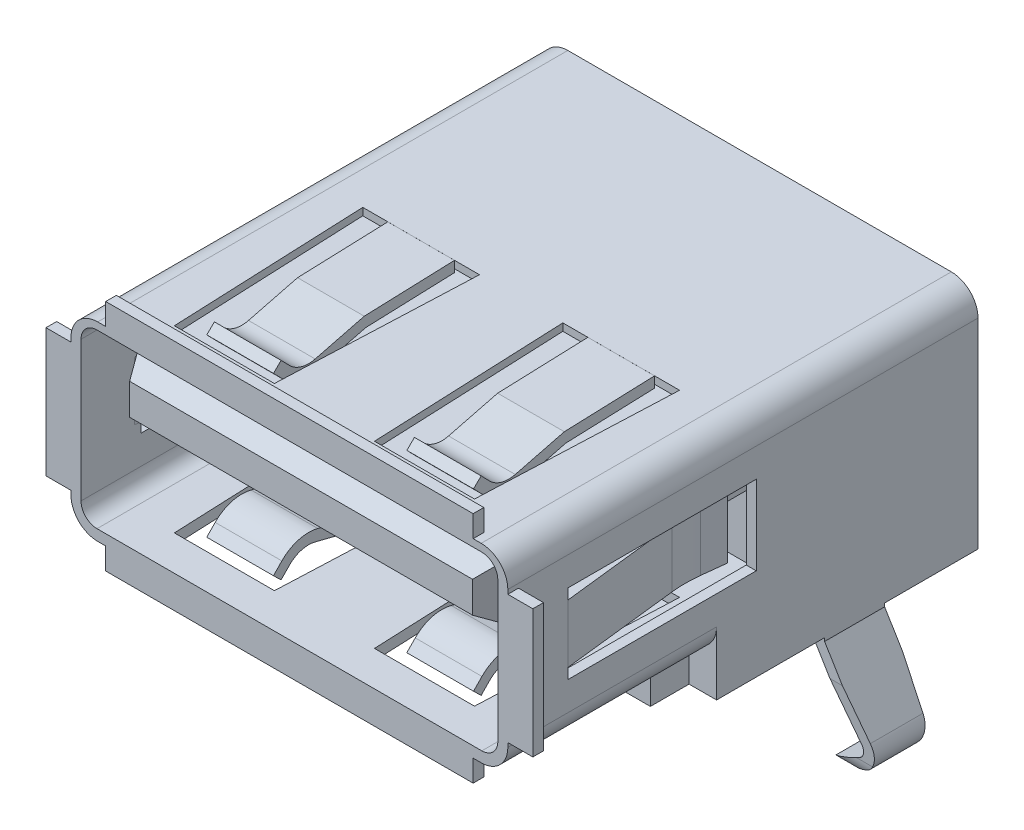
from build123d import *
from OCP.BRepFilletAPI import BRepFilletAPI_MakeChamfer

# Parameters (mm, degrees)
SKETCH1_W                           = 13.1
SKETCH1_H                           = 14.1
BASE_DEPTH                          = 5.7
SKETCH3_W                           = 11.02
SKETCH3_H                           = 0.65
SKETCH3_W_2                         = 0.75
SKETCH3_H_2                         = 3.85
FRONT_TABS_DEPTH                    = 0.32
CORNER_FILLETS_R                    = 0.8
D_BACK_STEP_DEPTH                   = 7.84
SKETCH19_W                          = 11.45
SKETCH19_H                          = 1.16
D_BOTTOM_STEP_DEPTH                 = 1.1
S_BACK_STEP_DEPTH                   = 5.2
SKETCH21_W                          = 2.4
SKETCH21_H                          = 3.2
S_BOTTOM_STEP_DEPTH                 = 1.1
GROUND_TAIL_1_DEPTH                 = 0.9
GROUND_TAIL_1_SHAPE_DEPTH           = 8
SKETCH23_W                          = 0.6604
SKETCH23_H                          = 0.31
TH_CONTACT_TAIL_DEPTH               = 3.9
CONTACT_AREA_CUTOUT_DEPTH           = 8.85
TOP_BOTTOM_FLANGE_CUTOUT_DEPTH      = 5.8
TOP_BOTTOM_FLANGE_DEPTH             = 1
TOP_BOTTOM_FLANGE_PATTERN_COUNT     = 2
TOP_BOTTOM_FLANGE_PATTERN_PITCH     = 6
SKETCH14_W                          = 5.65
SKETCH14_H                          = 2.38
SIDE_FLANGE_CUTOUT_DEPTH            = 18.286627863
SIDE_FLANGE_DEPTH                   = 0.875
SKETCH16_W                          = 11.15
SKETCH16_H                          = 1.8
CONTACT_GUIDE_DEPTH                 = 8.5
CONTACT_GUIDE_LEAD_IN_SIZE          = 0.75
CONTACT_GUIDE_LEAD_IN_SIZE2         = 0.433012702
CONTACT_DEPTH                       = 0.33
CONTACT_PATTERN_COUNT               = 2
CONTACT_PATTERN_PITCH               = 2.5
CONTACT_PATTERN_MIRROR_COPY_1_DEPTH = 0.33


with BuildPart() as part:
    # Sketch1 → Base (new body)
    with BuildSketch(Plane(origin=(0, 0, 0), x_dir=(1, 0, 0), z_dir=(0, 1, 0))):
        Rectangle(SKETCH1_W, SKETCH1_H)
    extrude(amount=BASE_DEPTH)

    # Sketch3 → Front Tabs (add)
    with BuildSketch(Plane.XY.offset(7.05)):
        with Locations((0, 6.025)):
            Rectangle(SKETCH3_W, SKETCH3_H)
        with Locations((6.925, 2.85)):
            Rectangle(SKETCH3_W_2, SKETCH3_H_2)
        with Locations((0, -0.325)):
            Rectangle(SKETCH3_W, SKETCH3_H)
        with Locations((-6.925, 2.85)):
            Rectangle(SKETCH3_W_2, SKETCH3_H_2)
    extrude(amount=-FRONT_TABS_DEPTH)

    # Corner Fillets
    corner_fillets_edges = [part.edges().sort_by_distance(p)[0] for p in [
        (-6.55, 5.7, 0),
        (-6.55, 0, 0),
        (6.55, 0, 0),
        (6.55, 5.7, 0),
    ]]
    fillet(corner_fillets_edges, radius=CORNER_FILLETS_R)

    # Sketch18 → -D Back Step (add)
    with BuildSketch(Plane(origin=(0, 0, -7.05), x_dir=(-1, 0, 0), z_dir=(0, 0, -1))):
        with BuildLine():
            Line((-6.55, 0.8), (-6.55, -1.1))
            Line((-6.55, -1.1), (6.55, -1.1))
            Line((6.55, -1.1), (6.55, 0.8))
            ThreePointArc((6.55, 0.8), (6.315685425, 0.234314575), (5.75, 0))
            Line((5.75, 0), (-5.75, 0))
            ThreePointArc((-5.75, 0), (-6.315685425, 0.234314575), (-6.55, 0.8))
        make_face()
    extrude(amount=-D_BACK_STEP_DEPTH)

    # Sketch19 → -D Bottom Step (add)
    with BuildSketch(Plane.XZ):
        with Locations((0, 1.37)):
            Rectangle(SKETCH19_W, SKETCH19_H)
    extrude(amount=D_BOTTOM_STEP_DEPTH)

    # Sketch22 → -S Back Step (add)
    with BuildSketch(Plane(origin=(0, 0, -7.05), x_dir=(-1, 0, 0), z_dir=(0, 0, -1))):
        with BuildLine():
            Line((-6.55, 0.8), (-6.55, -1.1))
            Line((-6.55, -1.1), (6.55, -1.1))
            Line((6.55, -1.1), (6.55, 0.8))
            ThreePointArc((6.55, 0.8), (6.315685425, 0.234314575), (5.75, 0))
            Line((5.75, 0), (-5.75, 0))
            ThreePointArc((-5.75, 0), (-6.315685425, 0.234314575), (-6.55, 0.8))
        make_face()
    extrude(amount=-S_BACK_STEP_DEPTH)

    # Sketch21 → -S Bottom Step (add)
    with BuildSketch(Plane.XZ):
        with Locations((0, -0.25)):
            Rectangle(SKETCH21_W, SKETCH21_H)
    extrude(amount=S_BOTTOM_STEP_DEPTH)

    # Sketch10 → Ground Tail 1 (add, symmetric)
    with BuildSketch(Plane.XY.offset(-3.35)):
        with BuildLine():
            Line((6.55, -1.2), (6.55, -1.1))
            Line((6.55, -1.1), (6.23, -1.1))
            Line((6.23, -1.1), (6.23, -1.289427281))
            Line((6.23, -1.289427281), (7.53653566, -3.444470404))
            ThreePointArc((7.53653566, -3.444470404), (7.568809506, -3.681173083), (7.417946806, -3.866403226))
            Line((7.417946806, -3.866403226), (6.55, -4.315836559))
            Line((6.55, -4.315836559), (6.69714326, -4.6))
            Line((6.69714326, -4.6), (7.565090066, -4.150566667))
            ThreePointArc((7.565090066, -4.150566667), (7.876872978, -3.767757706), (7.810173696, -3.278572167))
            Line((7.810173696, -3.278572167), (6.55, -1.2))
        make_face()
        with BuildLine():
            Line((-6.55, -1.1), (-6.23, -1.1))
            Line((-6.23, -1.1), (-6.23, -1.289427281))
            Line((-6.23, -1.289427281), (-7.53653566, -3.444470404))
            ThreePointArc((-7.53653566, -3.444470404), (-7.568809506, -3.681173083), (-7.417946806, -3.866403226))
            Line((-7.417946806, -3.866403226), (-6.55, -4.315836559))
            Line((-6.55, -4.315836559), (-6.69714326, -4.6))
            Line((-6.69714326, -4.6), (-7.565090066, -4.150566667))
            ThreePointArc((-7.565090066, -4.150566667), (-7.876872978, -3.767757706), (-7.810173696, -3.278572167))
            Line((-7.810173696, -3.278572167), (-6.55, -1.2))
            Line((-6.55, -1.2), (-6.55, -1.1))
        make_face()
    extrude(amount=GROUND_TAIL_1_DEPTH, both=True)

    # Sketch11 → Ground Tail 1 Shape (cut, symmetric)
    with BuildSketch(Plane(origin=(0, 0, 0), x_dir=(0, 0, -1), z_dir=(1, 0, 0))):
        with BuildLine():
            Line((2.425, -1.809071665), (2.618297835, -3.906504778))
            ThreePointArc((2.618297835, -3.906504778), (3.35, -4.573874551), (4.081702165, -3.906504778))
            Line((4.081702165, -3.906504778), (4.275, -1.809071665))
            Line((4.275, -1.809071665), (4.275, -4.939071665))
            Line((4.275, -4.939071665), (2.425, -4.939071665))
            Line((2.425, -4.939071665), (2.425, -1.809071665))
        make_face()
    extrude(amount=GROUND_TAIL_1_SHAPE_DEPTH, both=True, mode=Mode.SUBTRACT)

    # Sketch23 → -TH Contact Tail (add)
    with BuildSketch(Plane.XZ):
        with Locations((-3.5098, -6.0678)):
            Rectangle(SKETCH23_W, SKETCH23_H)
        with Locations((3.4902, -6.0678)):
            Rectangle(SKETCH23_W, SKETCH23_H)
        with Locations((-1.0098, -6.0678)):
            Rectangle(SKETCH23_W, SKETCH23_H)
        with Locations((0.9902, -6.0678)):
            Rectangle(SKETCH23_W, SKETCH23_H)
    extrude(amount=TH_CONTACT_TAIL_DEPTH)

    # Sketch8 → Contact Area Cutout (cut)
    with BuildSketch(Plane.XY.offset(7.05)):
        with BuildLine():
            Line((-6.25, 5), (-6.25, 0.8))
            ThreePointArc((-6.25, 0.8), (-6.109411255, 0.460588745), (-5.77, 0.32))
            Line((-5.77, 0.32), (5.77, 0.32))
            ThreePointArc((5.77, 0.32), (6.109411255, 0.460588745), (6.25, 0.8))
            Line((6.25, 0.8), (6.25, 5))
            ThreePointArc((6.25, 5), (6.109411255, 5.339411255), (5.77, 5.48))
            Line((5.77, 5.48), (-5.77, 5.48))
            ThreePointArc((-5.77, 5.48), (-6.109411255, 5.339411255), (-6.25, 5))
        make_face()
    extrude(amount=-CONTACT_AREA_CUTOUT_DEPTH, mode=Mode.SUBTRACT)

    # Sketch12 → Top/Bottom Flange Cutout (cut)
    with BuildSketch(Plane(origin=(0, 0, 0), x_dir=(-1, 0, 0), z_dir=(0, 1, 0))):
        Polygon((4.5, 6), (4.75, 0.1), (1.25, 0.1), (1.5, 6), align=None)
        Polygon((-4.75, 0.1), (-1.25, 0.1), (-1.5, 6), (-4.5, 6), align=None)
    extrude(amount=TOP_BOTTOM_FLANGE_CUTOUT_DEPTH, mode=Mode.SUBTRACT)

    # Sketch13 → Top/Bottom Flange (add, symmetric)
    with BuildSketch(Plane(origin=(-3, 0, 0), x_dir=(0, 0, -1), z_dir=(1, 0, 0))):
        with BuildLine():
            Line((-2.760063847, 0.417489088), (-4.198269078, 0.784212886))
            ThreePointArc((-4.198269078, 0.784212886), (-4.778069903, 0.777154214), (-5.276638422, 0.481099735))
            Line((-5.276638422, 0.481099735), (-5.529039549, 0.222413302))
            Line((-5.529039549, 0.222413302), (-5.3, -0.001061272))
            Line((-5.3, -0.001061272), (-5.047598873, 0.257625162))
            ThreePointArc((-5.047598873, 0.257625162), (-4.691478502, 0.469092647), (-4.277335056, 0.474134555))
            Line((-4.277335056, 0.474134555), (-2.8059045, 0.098938728))
            Line((-2.8059045, 0.098938728), (-0.1, 0.001))
            Line((-0.1, 0.001), (-0.1, 0.321209538))
            Line((-0.1, 0.321209538), (-2.760063847, 0.417489088))
        make_face()
        with BuildLine():
            Line((-2.8059045, 5.601061272), (-4.277335056, 5.225865445))
            ThreePointArc((-4.277335056, 5.225865445), (-4.691478502, 5.230907353), (-5.047598873, 5.442374838))
            Line((-5.047598873, 5.442374838), (-5.3, 5.701061272))
            Line((-5.3, 5.701061272), (-5.529039549, 5.477586698))
            Line((-5.529039549, 5.477586698), (-5.276638422, 5.218900265))
            ThreePointArc((-5.276638422, 5.218900265), (-4.778069903, 4.922845786), (-4.198269078, 4.915787114))
            Line((-4.198269078, 4.915787114), (-2.760063847, 5.282510912))
            Line((-2.760063847, 5.282510912), (-0.1, 5.378790462))
            Line((-0.1, 5.378790462), (-0.1, 5.699))
            Line((-0.1, 5.699), (-2.8059045, 5.601061272))
        make_face()
    top_bottom_flange = extrude(amount=TOP_BOTTOM_FLANGE_DEPTH, both=True)

    # Top/Bottom Flange Pattern: Top/Bottom Flange ×2
    with Locations(*[(i * TOP_BOTTOM_FLANGE_PATTERN_PITCH, 0, 0) for i in range(1, TOP_BOTTOM_FLANGE_PATTERN_COUNT)]):
        add(top_bottom_flange)

    # Sketch14 → Side Flange Cutout (cut, through all)
    with BuildSketch(Plane(origin=(6.55, 0, 0), x_dir=(0, 0, -1), z_dir=(1, 0, 0))):
        with Locations((-2.425, 2.85)):
            Rectangle(SKETCH14_W, SKETCH14_H)
    extrude(amount=-SIDE_FLANGE_CUTOUT_DEPTH, mode=Mode.SUBTRACT)

    # Sketch15 → Side Flange (add, symmetric)
    with BuildSketch(Plane(origin=(0, 2.85, 0), x_dir=(-1, 0, 0), z_dir=(0, 1, 0))):
        with BuildLine():
            Line((6.55, 5.25), (6.149012428, 1.723694006))
            ThreePointArc((6.149012428, 1.723694006), (6.125000079, 1.300770202), (6.148838699, 0.87783657))
            Line((6.148838699, 0.87783657), (6.231300503, 0.15))
            Line((6.231300503, 0.15), (5.913334739, 0.113975387))
            Line((5.913334739, 0.113975387), (5.830872935, 0.841811958))
            ThreePointArc((5.830872935, 0.841811958), (5.805000086, 1.300835926), (5.831061488, 1.759849227))
            Line((5.831061488, 1.759849227), (6.25, 5.444016737))
            Line((6.25, 5.444016737), (6.55, 5.25))
        make_face()
        with BuildLine():
            Line((-5.913334739, 0.113975387), (-6.231300503, 0.15))
            Line((-6.231300503, 0.15), (-6.148838699, 0.87783657))
            ThreePointArc((-6.148838699, 0.87783657), (-6.125000079, 1.300770202), (-6.149012428, 1.723694006))
            Line((-6.149012428, 1.723694006), (-6.55, 5.25))
            Line((-6.55, 5.25), (-6.25, 5.444016737))
            Line((-6.25, 5.444016737), (-5.831061488, 1.759849227))
            ThreePointArc((-5.831061488, 1.759849227), (-5.805000086, 1.300835926), (-5.830872935, 0.841811958))
            Line((-5.830872935, 0.841811958), (-5.913334739, 0.113975387))
        make_face()
    extrude(amount=SIDE_FLANGE_DEPTH, both=True)

    # Sketch16 → Contact Guide (add)
    with BuildSketch(Plane.XY.offset(-1.8)):
        with Locations((0, 3.82)):
            Rectangle(SKETCH16_W, SKETCH16_H)
    extrude(amount=CONTACT_GUIDE_DEPTH)

    # Contact Guide Lead-in: one chamfer whose edges measure the first distance from different faces: ONE call of the kernel's chamfer builder (chamfer() names one face for all edges)
    contact_guide_lead_in_edges_1 = [part.edges().sort_by_distance(p)[0] for p in [
        (5.575, 3.82, 6.7),
    ]]
    contact_guide_lead_in_side_1 = [part.faces().sort_by_distance(p)[0] for p in [
        (5.575, 3.82, 2.45),
    ]]
    contact_guide_lead_in_edges_2 = [part.edges().sort_by_distance(p)[0] for p in [
        (0, 4.72, 6.7),
    ]]
    contact_guide_lead_in_side_2 = [part.faces().sort_by_distance(p)[0] for p in [
        (0, 4.72, 2.45),
    ]]
    contact_guide_lead_in_edges_3 = [part.edges().sort_by_distance(p)[0] for p in [
        (-5.575, 3.82, 6.7),
    ]]
    contact_guide_lead_in_side_3 = [part.faces().sort_by_distance(p)[0] for p in [
        (-5.575, 3.82, 2.45),
    ]]
    contact_guide_lead_in_edges_4 = [part.edges().sort_by_distance(p)[0] for p in [
        (0, 2.92, 6.7),
    ]]
    contact_guide_lead_in_side_4 = [part.faces().sort_by_distance(p)[0] for p in [
        (0, 2.92, 2.45),
    ]]
    contact_guide_lead_in = BRepFilletAPI_MakeChamfer(part.part.solid().wrapped)
    for e in contact_guide_lead_in_edges_1:
        contact_guide_lead_in.Add(CONTACT_GUIDE_LEAD_IN_SIZE, CONTACT_GUIDE_LEAD_IN_SIZE2, e.wrapped, contact_guide_lead_in_side_1[0].wrapped)  # the first distance lies on this face
    for e in contact_guide_lead_in_edges_2:
        contact_guide_lead_in.Add(CONTACT_GUIDE_LEAD_IN_SIZE, CONTACT_GUIDE_LEAD_IN_SIZE2, e.wrapped, contact_guide_lead_in_side_2[0].wrapped)  # the first distance lies on this face
    for e in contact_guide_lead_in_edges_3:
        contact_guide_lead_in.Add(CONTACT_GUIDE_LEAD_IN_SIZE, CONTACT_GUIDE_LEAD_IN_SIZE2, e.wrapped, contact_guide_lead_in_side_3[0].wrapped)  # the first distance lies on this face
    for e in contact_guide_lead_in_edges_4:
        contact_guide_lead_in.Add(CONTACT_GUIDE_LEAD_IN_SIZE, CONTACT_GUIDE_LEAD_IN_SIZE2, e.wrapped, contact_guide_lead_in_side_4[0].wrapped)  # the first distance lies on this face
    add(Compound.cast(contact_guide_lead_in.Shape()), mode=Mode.REPLACE)

    # Sketch17 → Contact (add, symmetric)
    with BuildSketch(Plane(origin=(-3.5, 0, 0), x_dir=(0, 0, -1), z_dir=(1, 0, 0))):
        with BuildLine():
            Line((1.8, 3.91), (1.8, 3.65))
            Line((1.8, 3.65), (0.55, 3.65))
            Line((0.55, 3.65), (-3.012949724, 2.507463672))
            ThreePointArc((-3.012949724, 2.507463672), (-3.992552697, 2.419100424), (-4.916249642, 2.757056047))
            Line((-4.916249642, 2.757056047), (-5.45, 3.1))
            Line((-5.45, 3.1), (-5.309455597, 3.31874019))
            Line((-5.309455597, 3.31874019), (-4.775705239, 2.975796237))
            ThreePointArc((-4.775705239, 2.975796237), (-3.958746608, 2.676893264), (-3.092342201, 2.755045647))
            Line((-3.092342201, 2.755045647), (0.509332591, 3.91))
            Line((0.509332591, 3.91), (1.8, 3.91))
        make_face()
    contact = extrude(amount=CONTACT_DEPTH, both=True)

    # Contact Pattern: Contact ×2
    with Locations(*[(i * CONTACT_PATTERN_PITCH, 0, 0) for i in range(1, CONTACT_PATTERN_COUNT)]):
        add(contact)

    # Contact Pattern Mirror: Contact across plane
    add(contact.mirror(Plane(origin=(0, 0, 0), x_dir=(0, 0, 1), z_dir=(1, 0, 0))))

    # Contact Pattern Mirror copy 1 sketch → Contact Pattern Mirror copy 1 (add, symmetric)
    with BuildSketch(Plane(origin=(1, 0, 0), x_dir=(0, 0, -1), z_dir=(-1, 0, 0))):
        with BuildLine():
            Line((1.8, -3.91), (1.8, -3.65))
            Line((1.8, -3.65), (0.55, -3.65))
            Line((0.55, -3.65), (-3.012949724, -2.507463672))
            ThreePointArc((-3.012949724, -2.507463672), (-3.992552697, -2.419100424), (-4.916249642, -2.757056047))
            Line((-4.916249642, -2.757056047), (-5.45, -3.1))
            Line((-5.45, -3.1), (-5.309455597, -3.31874019))
            Line((-5.309455597, -3.31874019), (-4.775705239, -2.975796237))
            ThreePointArc((-4.775705239, -2.975796237), (-3.958746608, -2.676893264), (-3.092342201, -2.755045647))
            Line((-3.092342201, -2.755045647), (0.509332591, -3.91))
            Line((0.509332591, -3.91), (1.8, -3.91))
        make_face()
    extrude(amount=CONTACT_PATTERN_MIRROR_COPY_1_DEPTH, both=True)


solid = part.part
